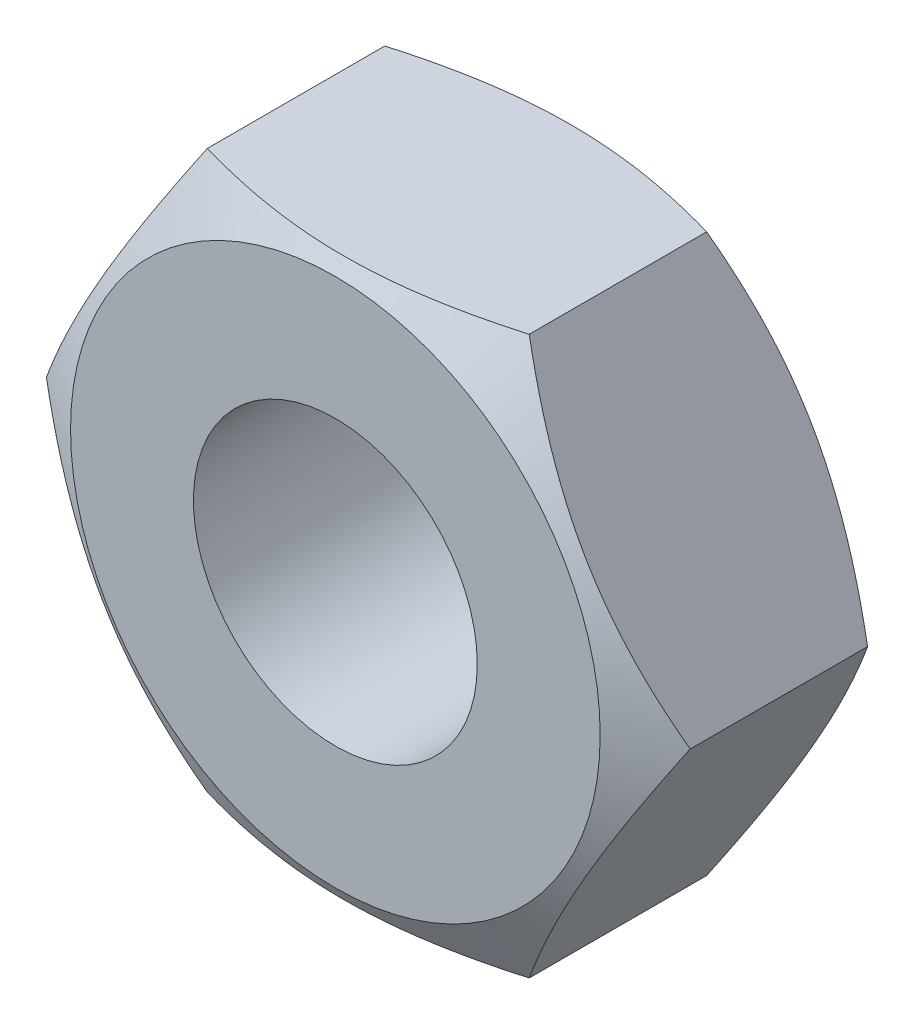
from build123d import *

# Parameters (mm, degrees)
F_0181_EXTRUDE_DEPTH        = 2.4
F_0181_EXTRUDE_ROTATE_ANGLE = 120
F_0180_REVOLVE_ROTATE_ANGLE = 90
F_0183_CYLINDER_SKETCH_R    = 1.4
F_0183_CYLINDER_DEPTH       = 10


with BuildPart() as part:
    # 0181_extrude_Sketch → 0181_extrude (new body)
    with BuildSketch(Plane.XY):
        Polygon((0, 0), (3.175426481, 0), (4.763139721, 2.75), (3.175426481, 5.5), (0, 5.5), (-1.58771324, 2.75), align=None)
    extrude(amount=F_0181_EXTRUDE_DEPTH)


with BuildPart() as part_1:
    # 0181_extrude_Rotate: moved
    add(part.part.rotate(Axis((0, 0, 0), (0, 0, 1)), F_0181_EXTRUDE_ROTATE_ANGLE))


with BuildPart() as part_2:
    # 0181_extrude_Translate: moved
    add(part_1.part.moved(Location((3.175426481, 0, 0))))


with BuildPart() as body_2:
    # 0180_revolve_Sketch → 0180_revolve (revolve)
    with BuildSketch(Plane.XY, mode=Mode.PRIVATE) as f_0180_revolve_sk:
        Polygon((0, 0), (2.6125, 0), (3.675426481, 0.61368089), (3.675426481, 1.78631911), (2.6125, 2.4), (0, 2.4), align=None)
    revolve(f_0180_revolve_sk.sketch.rotate(Axis((0, -100, 0), (0, 1, 0)), 90), axis=Axis((0, -100, 0), (0, 1, 0)))


with BuildPart() as body_2_1:
    # 0180_revolve_Rotate: moved
    add(body_2.part.rotate(Axis((0, 0, 0), (1, 0, 0)), F_0180_REVOLVE_ROTATE_ANGLE))


with BuildPart() as part_3:
    add(part_2.part)

    # 0182_common: intersect body 2
    add(body_2_1.part, mode=Mode.INTERSECT)


with BuildPart() as body_2_2:
    # 0183_cylinder_Sketch → 0183_cylinder (new body)
    with BuildSketch(Plane.XY):
        Circle(F_0183_CYLINDER_SKETCH_R)
    extrude(amount=F_0183_CYLINDER_DEPTH)


with BuildPart() as body_2_2_1:
    # 0183_cylinder_Translate: moved
    add(body_2_2.part.moved(Location((0, 0, -5))))


with BuildPart() as part_4:
    add(part_3.part)

    # 0184_sub: cut body 2 2
    add(body_2_2_1.part, mode=Mode.SUBTRACT)


solid = part_4.part
